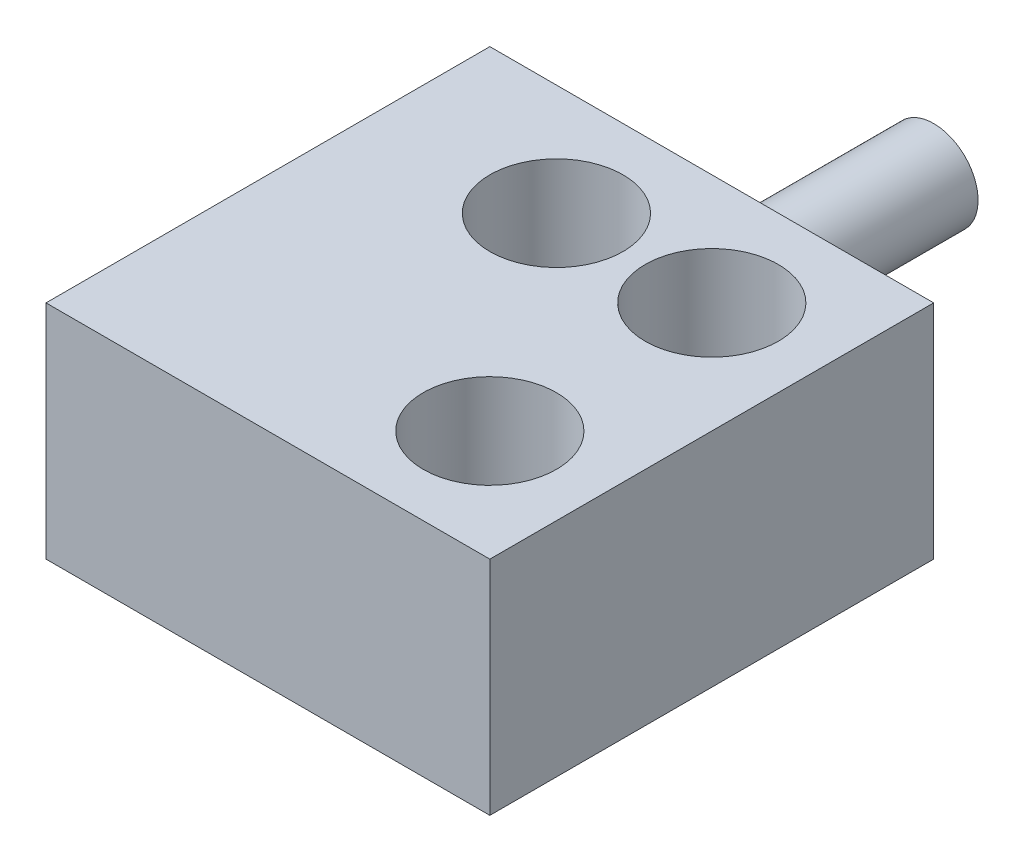
from build123d import *

# Parameters (mm, degrees)
SKETCH_1_W      = 10
SKETCH_1_H      = 10
SKETCH_1_R      = 1.5
EXTRUDE_1_DEPTH = 5
SKETCH_2_R      = 1
EXTRUDE_2_DEPTH = 5


with BuildPart() as part:
    # 草图1 → 凸台-拉伸1 (new body)
    with BuildSketch(Plane(origin=(0, 0, 0), x_dir=(1, 0, 0), z_dir=(0, 1, 0))):
        with Locations((5, 5)):
            Rectangle(SKETCH_1_W, SKETCH_1_H)
        with Locations(Location((7.5, 7.5, 0), (0, 0, 270))):
            Circle(SKETCH_1_R, mode=Mode.SUBTRACT)
        with Locations(Location((7.5, 2.5, 0), (0, 0, 270))):
            Circle(SKETCH_1_R, mode=Mode.SUBTRACT)
        with Locations(Location((4, 7.5, 0), (0, 0, 270))):
            Circle(SKETCH_1_R, mode=Mode.SUBTRACT)
    extrude(amount=EXTRUDE_1_DEPTH)

    # 草图2 → 凸台-拉伸2 (add)
    with BuildSketch(Plane(origin=(0, 0, -10), x_dir=(-1, 0, 0), z_dir=(0, 0, -1))):
        with Locations((-5, 2.5)):
            Circle(SKETCH_2_R)
    extrude(amount=EXTRUDE_2_DEPTH)


solid = part.part
